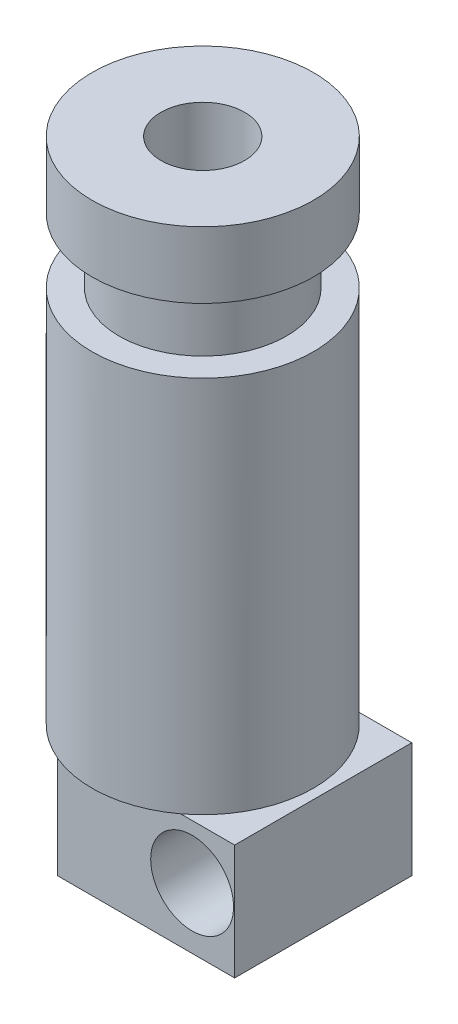
from build123d import *

# Parameters (mm, degrees)
SKETCH1_R           = 7.9375
BOSS_EXTRUDE1_DEPTH = 27.10000002
SKETCH2_R           = 3
CUT_EXTRUDE1_DEPTH  = 36.5
SKETCH3_R           = 6
BOSS_EXTRUDE2_DEPTH = 4.64
SKETCH4_R           = 7.9375
BOSS_EXTRUDE3_DEPTH = 4.76
CUT_EXTRUDE2_START  = -81.214
SKETCH5_R           = 3
CUT_EXTRUDE2_DEPTH  = 81.214
SKETCH8_W           = 12.7
SKETCH8_H           = 12.7
BOSS_EXTRUDE5_DEPTH = 8.255
SKETCH11_R          = 3.96875
BOSS_EXTRUDE7_DEPTH = 1.27
SKETCH12_R          = 3.96875
BOSS_EXTRUDE8_DEPTH = 1.778
BOSS_EXTRUDE8_TAPER = 65
SKETCH13_R          = 2.9718
CUT_EXTRUDE9_DEPTH  = 25.4
SKETCH14_R          = 0.02
CUT_EXTRUDE10_DEPTH = 254


with BuildPart() as part:
    # Sketch1 → Boss-Extrude1 (new body)
    with BuildSketch(Plane(origin=(0, 0, 0), x_dir=(1, 0, 0), z_dir=(0, 1, 0))):
        with Locations(Location((0, 0, 0), (0, 0, 270))):
            Circle(SKETCH1_R)
    extrude(amount=BOSS_EXTRUDE1_DEPTH)

    # Sketch2 → Cut-Extrude1 (cut)
    with BuildSketch(Plane(origin=(0, 27.10000002, 0), x_dir=(1, 0, 0), z_dir=(0, 1, 0))):
        with Locations(Location((0, 0, 0), (0, 0, 270))):
            Circle(SKETCH2_R)
    extrude(amount=-CUT_EXTRUDE1_DEPTH, mode=Mode.SUBTRACT)

    # Sketch3 → Boss-Extrude2 (add)
    with BuildSketch(Plane(origin=(0, 27.10000002, 0), x_dir=(1, 0, 0), z_dir=(0, 1, 0))):
        with Locations(Location((0, 0, 0), (0, 0, 270))):
            Circle(SKETCH3_R)
    extrude(amount=BOSS_EXTRUDE2_DEPTH)

    # Sketch4 → Boss-Extrude3 (add)
    with BuildSketch(Plane(origin=(0, 31.74000002, 0), x_dir=(1, 0, 0), z_dir=(0, 1, 0))):
        with Locations(Location((0, 0, 0), (0, 0, 270))):
            Circle(SKETCH4_R)
    extrude(amount=BOSS_EXTRUDE3_DEPTH)

    # Sketch5 → Cut-Extrude2 (cut)
    with BuildSketch(Plane.XZ.offset(CUT_EXTRUDE2_START)):
        with Locations(Location((0, 0, 0), (0, 0, 90))):
            Circle(SKETCH5_R)
    extrude(amount=CUT_EXTRUDE2_DEPTH, mode=Mode.SUBTRACT)

    # Sketch8 → Boss-Extrude5 (add)
    with BuildSketch(Plane.XZ):
        with Locations((2.286, 0)):
            Rectangle(SKETCH8_W, SKETCH8_H)
    extrude(amount=BOSS_EXTRUDE5_DEPTH)

    # Sketch11 → Boss-Extrude7 (add)
    with BuildSketch(Plane.XZ.offset(8.255)):
        with Locations(Location((0, 0, 0), (0, 0, 90))):
            Circle(SKETCH11_R)
    extrude(amount=BOSS_EXTRUDE7_DEPTH)

    # Sketch12 → Boss-Extrude8 (add)
    with BuildSketch(Plane(origin=(0, -9.525, 0), x_dir=(-1, 0, 0), z_dir=(0, -1, 0))):
        with Locations(Location((0, 0, 0), (0, 0, 270))):
            Circle(SKETCH12_R)
    extrude(amount=BOSS_EXTRUDE8_DEPTH, taper=BOSS_EXTRUDE8_TAPER)

    # Sketch13 → Cut-Extrude9 (cut)
    with BuildSketch(Plane(origin=(0, 0, -6.35), x_dir=(-1, 0, 0), z_dir=(0, 0, -1))):
        with Locations((-5.588, -3.888060816)):
            Circle(SKETCH13_R)
    extrude(amount=-CUT_EXTRUDE9_DEPTH, mode=Mode.SUBTRACT)

    # Sketch14 → Cut-Extrude10 (cut)
    with BuildSketch(Plane(origin=(0, 36.50000002, 0), x_dir=(1, 0, 0), z_dir=(0, 1, 0))):
        with Locations(Location((0, 0, 0), (0, 0, 270))):
            Circle(SKETCH14_R)
    extrude(amount=-CUT_EXTRUDE10_DEPTH, mode=Mode.SUBTRACT)


solid = part.part
